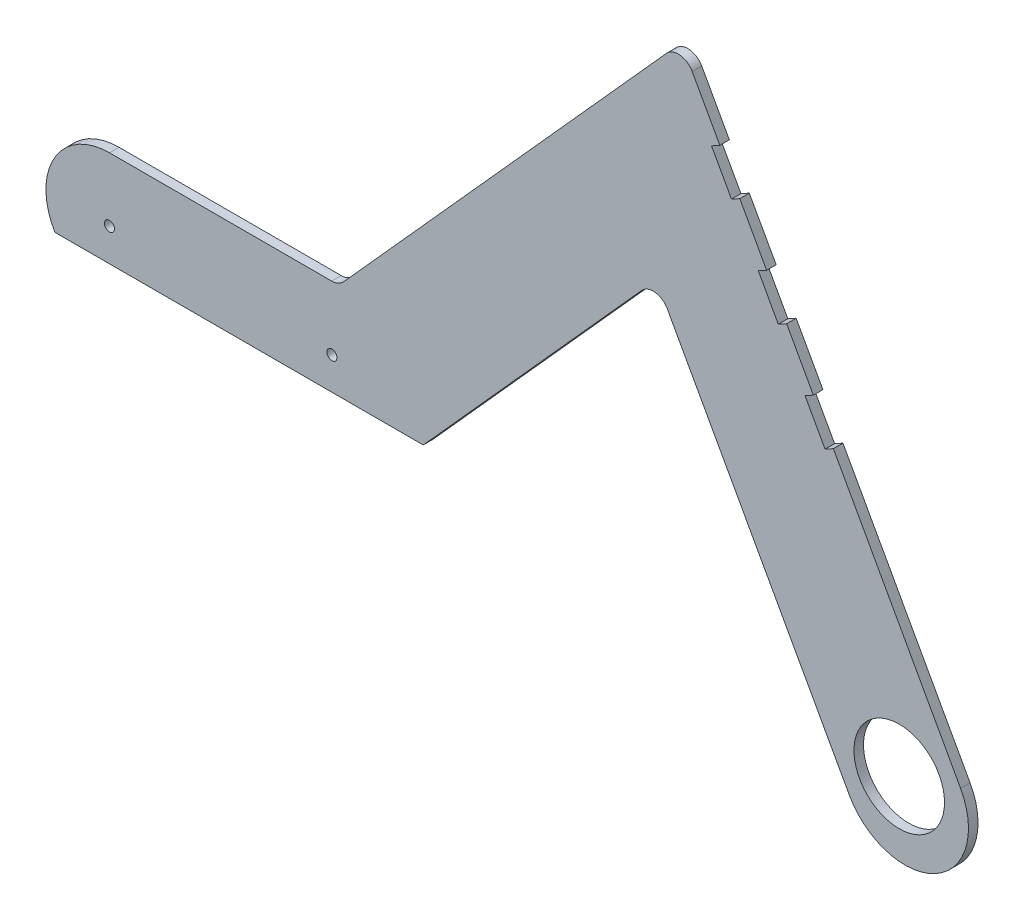
from build123d import *

# Parameters (mm, degrees)
CROQUIS1_R              = 1.58
CROQUIS1_R_2            = 14.25
SALIENTE_EXTRUIR1_DEPTH = 3
CROQUIS3_W              = 3
CROQUIS3_H              = 13.002457907
CROQUIS3_H_2            = 13.048194377
CROQUIS3_H_3            = 13.048194378
CORTAR_EXTRUIR1_DEPTH   = 3
CROQUIS4_W              = 144.23908533
CROQUIS4_H              = 10
CORTAR_EXTRUIR2_DEPTH   = 10


with BuildPart() as part:
    # Croquis1 → Saliente-Extruir1 (new body)
    with BuildSketch(Plane.XY):
        with BuildLine():
            Line((-135.811178416, 31.660861846), (-65.873242367, 31.660861846))
            ThreePointArc((-65.873242367, 31.660861846), (-63.837291884, 32.094144685), (-62.154198363, 33.318899594))
            Line((-62.154198363, 33.318899594), (39.488020824, 146.429658271))
            ThreePointArc((39.488020824, 146.429658271), (43.775922453, 148.055230719), (47.585333219, 145.502393908))
            Line((47.585333219, 145.502393908), (132.043103592, -7.634273033))
            ThreePointArc((132.043103592, -7.634273033), (124.188821584, -34.806138154), (97.016956463, -26.951856146))
            Line((97.016956463, -26.951856146), (39.731279169, 76.917067288))
            ThreePointArc((39.731279169, 76.917067288), (35.921868403, 79.4699041), (31.633966774, 77.844331652))
            Line((31.633966774, 77.844331652), (-44.321252629, -6.681100406))
            ThreePointArc((-44.321252629, -6.681100406), (-46.00434615, -7.905855315), (-48.040296633, -8.339138154))
            Line((-48.040296633, -8.339138154), (-135.811178416, -8.339138154))
            ThreePointArc((-135.811178416, -8.339138154), (-155.811178416, 11.660861846), (-135.811178416, 31.660861846))
        make_face()
        with Locations((-135.811178416, 11.660861846)):
            Circle(CROQUIS1_R, mode=Mode.SUBTRACT)
        with Locations((-65.81121578, 11.5885363)):
            Circle(CROQUIS1_R, mode=Mode.SUBTRACT)
        with Locations((112.738617641, -14.044921514)):
            Circle(CROQUIS1_R_2, mode=Mode.SUBTRACT)
    extrude(amount=SALIENTE_EXTRUIR1_DEPTH)

    # Croquis3 → Cortar-Extruir1 (cut)
    with BuildSketch(Plane(origin=(98.018165522, 54.058873563, 0), x_dir=(0, 0, -1), z_dir=(0.875653678217041, 0.4829395778200074, 0))):
        with Locations((-1.5, 79.927636726)):
            Rectangle(CROQUIS3_W, CROQUIS3_H)
        with Locations((-1.5, 49.42886568)):
            Rectangle(CROQUIS3_W, CROQUIS3_H_2)
        with Locations((-1.5, 18.952962868)):
            Rectangle(CROQUIS3_W, CROQUIS3_H_3)
    extrude(amount=-CORTAR_EXTRUIR1_DEPTH, mode=Mode.SUBTRACT)

    # Croquis4 → Cortar-Extruir2 (cut)
    with BuildSketch(Plane.XY.offset(3)):
        with Locations((-102.474853033, -3.605700694)):
            Rectangle(CROQUIS4_W, CROQUIS4_H)
    extrude(amount=-CORTAR_EXTRUIR2_DEPTH, mode=Mode.SUBTRACT)


solid = part.part
